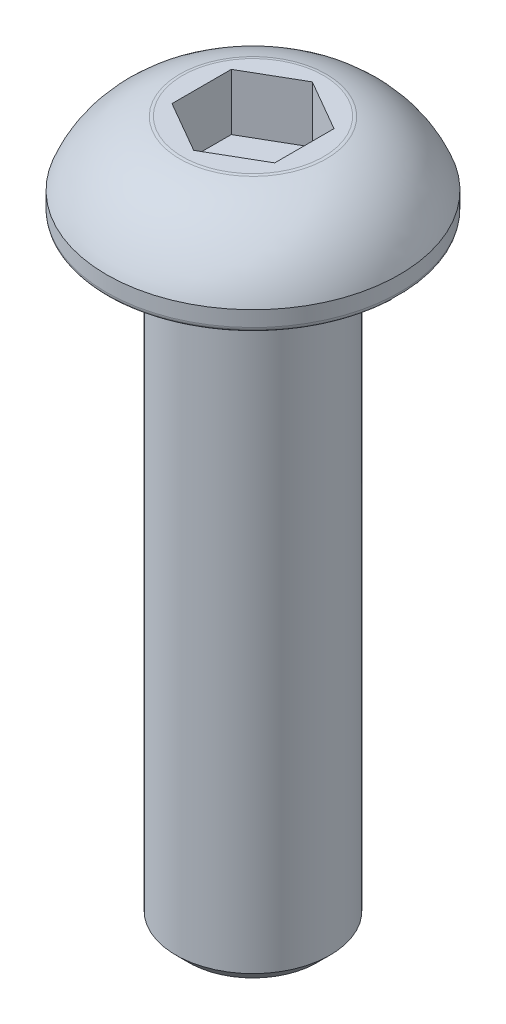
from build123d import *

# Parameters (mm, degrees)
CUT_EXTRUDE1_DEPTH = 1.1


with BuildPart() as part:
    # Sketch1 → Revolve1 (revolve)
    with BuildSketch(Plane.XY, mode=Mode.PRIVATE) as revolve1_sk:
        with BuildLine():
            Line((-1.5, -0.1), (-1.5, -11.75))
            Line((-1.5, -11.75), (-1.25, -12))
            Line((-1.25, -12), (0, -12))
            Line((0, -12), (0, 1.65))
            Line((0, 1.65), (-1.372450351, 1.65))
            ThreePointArc((-1.372450351, 1.65), (-1.400779398, 1.648389744), (-1.42874351, 1.643579721))
            ThreePointArc((-1.42874351, 1.643579721), (-2.295395633, 1.200105689), (-2.85, 0.4))
            Line((-2.85, 0.4), (-2.85, 0.1))
            ThreePointArc((-2.85, 0.1), (-2.820710678, 0.029289322), (-2.75, 0))
            Line((-2.75, 0), (-1.6, 0))
            ThreePointArc((-1.6, 0), (-1.529289322, -0.029289322), (-1.5, -0.1))
        make_face()
    revolve(revolve1_sk.sketch.rotate(Axis((0, -12, 0), (0, 1, 0)), 270), axis=Axis((0, -12, 0), (0, 1, 0)))

    # Sketch2 → Cut-Extrude1 (cut)
    with BuildSketch(Plane(origin=(0, 1.65, 0), x_dir=(1, 0, 0), z_dir=(0, 1, 0))):
        Polygon((-1, 0.577350269), (-1, -0.577350269), (0, -1.154700538), (1, -0.577350269), (1, 0.577350269), (0, 1.154700538), align=None)
    extrude(amount=-CUT_EXTRUDE1_DEPTH, mode=Mode.SUBTRACT)


solid = part.part
